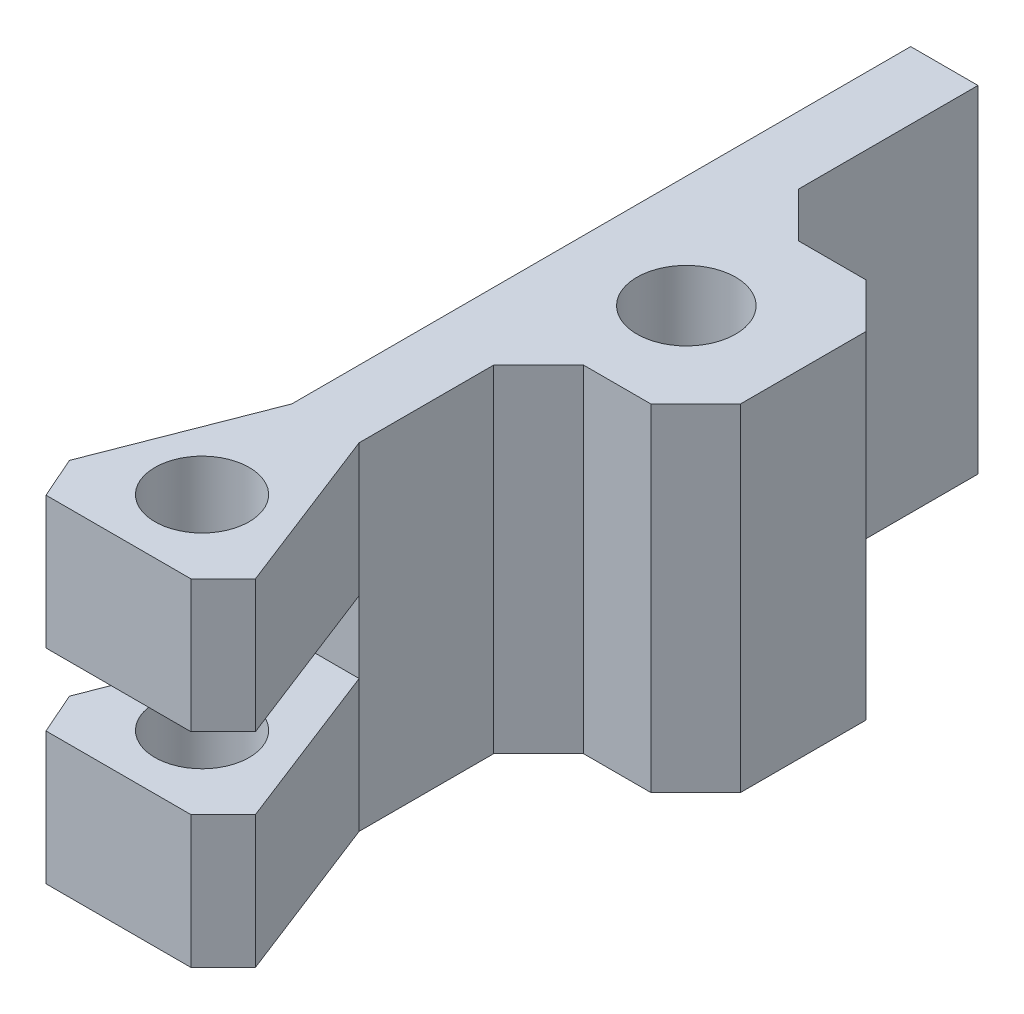
from build123d import *
from OCP.BRepFilletAPI import BRepFilletAPI_MakeChamfer

# Parameters (mm, degrees)
SKETCH1_R           = 2.794
SKETCH1_R_2         = 2.667
BOSS_EXTRUDE1_DEPTH = 19.05
CHAMFER1_SIZE       = 2.54
CHAMFER2_SIZE       = 2.54
CHAMFER2_SIZE2      = 1.962221924
SKETCH2_W           = 11.068186497
SKETCH2_H           = 4.064
NOTCH_DEPTH         = 11.43


with BuildPart() as part:
    # Sketch1 → Boss-Extrude1 (new body)
    with BuildSketch(Plane(origin=(0, 0, 0), x_dir=(1, 0, 0), z_dir=(0, 1, 0))):
        Polygon((-3.81, 46.459871133), (0, 46.459871133), (0, 33.759871133), (8.89, 33.759871133), (8.89, 21.59), (0, 21.59), (0, 11.43), (4.445, 0), (-8.255, 0), (-3.81, 11.43), align=None)
        with Locations(Location((2.54, 27.409871133, 0), (0, 0, 90))):
            Circle(SKETCH1_R, mode=Mode.SUBTRACT)
        with Locations(Location((-1.905, 4.445, 0), (0, 0, 90))):
            Circle(SKETCH1_R_2, mode=Mode.SUBTRACT)
    extrude(amount=BOSS_EXTRUDE1_DEPTH)

    # Chamfer1
    chamfer1_edges = [part.edges().sort_by_distance(p)[0] for p in [
        (0, 9.525, -21.59),
        (8.89, 9.525, -21.59),
        (8.89, 9.525, -33.759871133),
        (0, 9.525, -33.759871133),
    ]]
    chamfer(chamfer1_edges, length=CHAMFER1_SIZE)

    # Chamfer2: one chamfer whose edges measure the first distance from different faces: ONE call of the kernel's chamfer builder (chamfer() names one face for all edges)
    chamfer2_edges_1 = [part.edges().sort_by_distance(p)[0] for p in [
        (4.445, 9.525, 0),
    ]]
    chamfer2_side_1 = [part.faces().sort_by_distance(p)[0] for p in [
        (-1.905, 9.525, 0),
    ]]
    chamfer2_edges_2 = [part.edges().sort_by_distance(p)[0] for p in [
        (-8.255, 9.525, 0),
    ]]
    chamfer2_side_2 = [part.faces().sort_by_distance(p)[0] for p in [
        (-6.0325, 9.525, -5.715),
    ]]
    chamfer2 = BRepFilletAPI_MakeChamfer(part.part.solid().wrapped)
    for e in chamfer2_edges_1:
        chamfer2.Add(CHAMFER2_SIZE, CHAMFER2_SIZE2, e.wrapped, chamfer2_side_1[0].wrapped)  # the first distance lies on this face
    for e in chamfer2_edges_2:
        chamfer2.Add(CHAMFER2_SIZE, CHAMFER2_SIZE2, e.wrapped, chamfer2_side_2[0].wrapped)  # the first distance lies on this face
    add(Compound.cast(chamfer2.Shape()), mode=Mode.REPLACE)

    # Sketch2 → notch (cut)
    with BuildSketch(Plane.XY):
        with Locations((-1.800293249, 9.525)):
            Rectangle(SKETCH2_W, SKETCH2_H)
    extrude(amount=-NOTCH_DEPTH, mode=Mode.SUBTRACT)


solid = part.part
